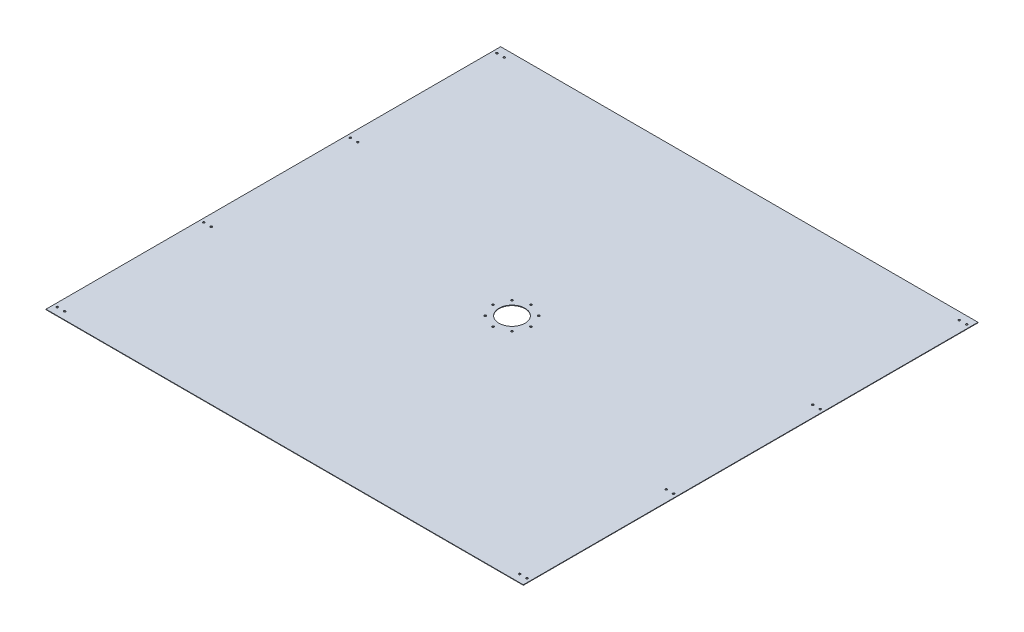
from build123d import *

# Parameters (mm, degrees)
SKETCH1_W               = 1314.45
SKETCH1_H               = 1219.2
BOSS_EXTRUDE1_DEPTH     = 1.27
SKETCH2_OUTSIDE_W       = 1675.016
SKETCH2_OUTSIDE_H       = 1579.766
SKETCH2_OUTSIDE_W_2     = 1280
SKETCH2_OUTSIDE_H_2     = 1219.2
CUT_EXTRUDE1_DEPTH      = 2.54
SKETCH3_R               = 2.65
CUT_EXTRUDE2_DEPTH      = 884.862983103
LPATTERN2_COUNT         = 4
LPATTERN2_PITCH         = 393.0226582
LPATTERN2_COUNT_DIR2    = 2
LPATTERN2_PITCH_DIR2    = 20
MIRROR1_COPY_1_SKETCH_R = 2.65
MIRROR1_COPY_1_DEPTH    = 884.862983103
MIRROR1_COPY_2_SKETCH_R = 2.65
MIRROR1_COPY_2_DEPTH    = 884.862983103
MIRROR1_COPY_3_SKETCH_R = 2.65
MIRROR1_COPY_3_DEPTH    = 884.862983103
MIRROR1_COPY_4_SKETCH_R = 2.65
MIRROR1_COPY_4_DEPTH    = 884.862983103
MIRROR1_COPY_5_SKETCH_R = 2.65
MIRROR1_COPY_5_DEPTH    = 884.862983103
MIRROR1_COPY_6_SKETCH_R = 2.65
MIRROR1_COPY_6_DEPTH    = 884.862983103
MIRROR1_COPY_7_SKETCH_R = 2.65
MIRROR1_COPY_7_DEPTH    = 884.862983103
MIRROR1_COPY_8_SKETCH_R = 2.65
MIRROR1_COPY_8_DEPTH    = 884.862983103
SKETCH5_R               = 34.925
CUT_EXTRUDE4_DEPTH      = 884.862983103
F_1_0MM_DOWEL_HOLE2_D   = 5.3
CIRPATTERN1_COUNT       = 8


with BuildPart() as part:
    # Sketch1 → Boss-Extrude1 (new body)
    with BuildSketch(Plane(origin=(0, 0, 0), x_dir=(1, 0, 0), z_dir=(0, 1, 0))):
        Rectangle(SKETCH1_W, SKETCH1_H)
    extrude(amount=BOSS_EXTRUDE1_DEPTH)

    # Sketch2 outside → Cut-Extrude1 (cut)
    with BuildSketch(Plane(origin=(0, 1.27, 0), x_dir=(1, 0, 0), z_dir=(0, 1, 0))):
        Rectangle(SKETCH2_OUTSIDE_W, SKETCH2_OUTSIDE_H)
        Rectangle(SKETCH2_OUTSIDE_W_2, SKETCH2_OUTSIDE_H_2, mode=Mode.SUBTRACT)
    extrude(amount=-CUT_EXTRUDE1_DEPTH, mode=Mode.SUBTRACT)

    # Sketch3 → Cut-Extrude2 (cut, through all)
    with BuildSketch(Plane(origin=(0, 1.27, 0), x_dir=(1, 0, 0), z_dir=(0, 1, 0))):
        with Locations((-630, -589.6)):
            Circle(SKETCH3_R)
    cut_extrude2 = extrude(amount=-CUT_EXTRUDE2_DEPTH, mode=Mode.SUBTRACT)

    # LPattern2: Cut-Extrude2 4 × 2
    with Locations(*[(j * LPATTERN2_PITCH_DIR2, 0, -i * LPATTERN2_PITCH) for i in range(LPATTERN2_COUNT) for j in range(LPATTERN2_COUNT_DIR2) if (i, j) != (0, 0)]):
        add(cut_extrude2, mode=Mode.SUBTRACT)

    # Mirror1 copy 1 sketch → Mirror1 copy 1 (cut, through all)
    with BuildSketch(Plane(origin=(-20, 1.27, 0), x_dir=(-1, 0, 0), z_dir=(0, 1, 0))):
        with Locations((-630, 589.6)):
            Circle(MIRROR1_COPY_1_SKETCH_R)
    extrude(amount=-MIRROR1_COPY_1_DEPTH, mode=Mode.SUBTRACT)

    # Mirror1 copy 2 sketch → Mirror1 copy 2 (cut, through all)
    with BuildSketch(Plane(origin=(0, 1.27, -393.0226582), x_dir=(-1, 0, 0), z_dir=(0, 1, 0))):
        with Locations((-630, 589.6)):
            Circle(MIRROR1_COPY_2_SKETCH_R)
    extrude(amount=-MIRROR1_COPY_2_DEPTH, mode=Mode.SUBTRACT)

    # Mirror1 copy 3 sketch → Mirror1 copy 3 (cut, through all)
    with BuildSketch(Plane(origin=(-20, 1.27, -393.0226582), x_dir=(-1, 0, 0), z_dir=(0, 1, 0))):
        with Locations((-630, 589.6)):
            Circle(MIRROR1_COPY_3_SKETCH_R)
    extrude(amount=-MIRROR1_COPY_3_DEPTH, mode=Mode.SUBTRACT)

    # Mirror1 copy 4 sketch → Mirror1 copy 4 (cut, through all)
    with BuildSketch(Plane(origin=(0, 1.27, -786.0453164), x_dir=(-1, 0, 0), z_dir=(0, 1, 0))):
        with Locations((-630, 589.6)):
            Circle(MIRROR1_COPY_4_SKETCH_R)
    extrude(amount=-MIRROR1_COPY_4_DEPTH, mode=Mode.SUBTRACT)

    # Mirror1 copy 5 sketch → Mirror1 copy 5 (cut, through all)
    with BuildSketch(Plane(origin=(-20, 1.27, -786.0453164), x_dir=(-1, 0, 0), z_dir=(0, 1, 0))):
        with Locations((-630, 589.6)):
            Circle(MIRROR1_COPY_5_SKETCH_R)
    extrude(amount=-MIRROR1_COPY_5_DEPTH, mode=Mode.SUBTRACT)

    # Mirror1 copy 6 sketch → Mirror1 copy 6 (cut, through all)
    with BuildSketch(Plane(origin=(0, 1.27, -1179.0679746), x_dir=(-1, 0, 0), z_dir=(0, 1, 0))):
        with Locations((-630, 589.6)):
            Circle(MIRROR1_COPY_6_SKETCH_R)
    extrude(amount=-MIRROR1_COPY_6_DEPTH, mode=Mode.SUBTRACT)

    # Mirror1 copy 7 sketch → Mirror1 copy 7 (cut, through all)
    with BuildSketch(Plane(origin=(-20, 1.27, -1179.0679746), x_dir=(-1, 0, 0), z_dir=(0, 1, 0))):
        with Locations((-630, 589.6)):
            Circle(MIRROR1_COPY_7_SKETCH_R)
    extrude(amount=-MIRROR1_COPY_7_DEPTH, mode=Mode.SUBTRACT)

    # Mirror1 copy 8 sketch → Mirror1 copy 8 (cut, through all)
    with BuildSketch(Plane(origin=(0, 1.27, 0), x_dir=(-1, 0, 0), z_dir=(0, 1, 0))):
        with Locations((-630, 589.6)):
            Circle(MIRROR1_COPY_8_SKETCH_R)
    extrude(amount=-MIRROR1_COPY_8_DEPTH, mode=Mode.SUBTRACT)

    # Sketch5 → Cut-Extrude4 (cut, through all)
    with BuildSketch(Plane(origin=(0, 1.27, 0), x_dir=(1, 0, 0), z_dir=(0, 1, 0))):
        Circle(SKETCH5_R)
    extrude(amount=-CUT_EXTRUDE4_DEPTH, mode=Mode.SUBTRACT)

    # Ø1.0mm Dowel Hole2 (through all)
    with Locations(Plane(origin=(0, 0, 0), x_dir=(-1, 0, 0), z_dir=(0, -1, 0))):
        with Locations((0, 50.8)):
            f_1_0mm_dowel_hole2 = Hole(F_1_0MM_DOWEL_HOLE2_D / 2)

    # CirPattern1: Ø1.0mm Dowel Hole2 ×8 about axis
    cirpattern1_axis = Axis((0, 1.3335, 0), (0, -1, 0))
    for i in range(1, CIRPATTERN1_COUNT):
        add(f_1_0mm_dowel_hole2.rotate(cirpattern1_axis, i * 360 / CIRPATTERN1_COUNT), mode=Mode.SUBTRACT)


solid = part.part
